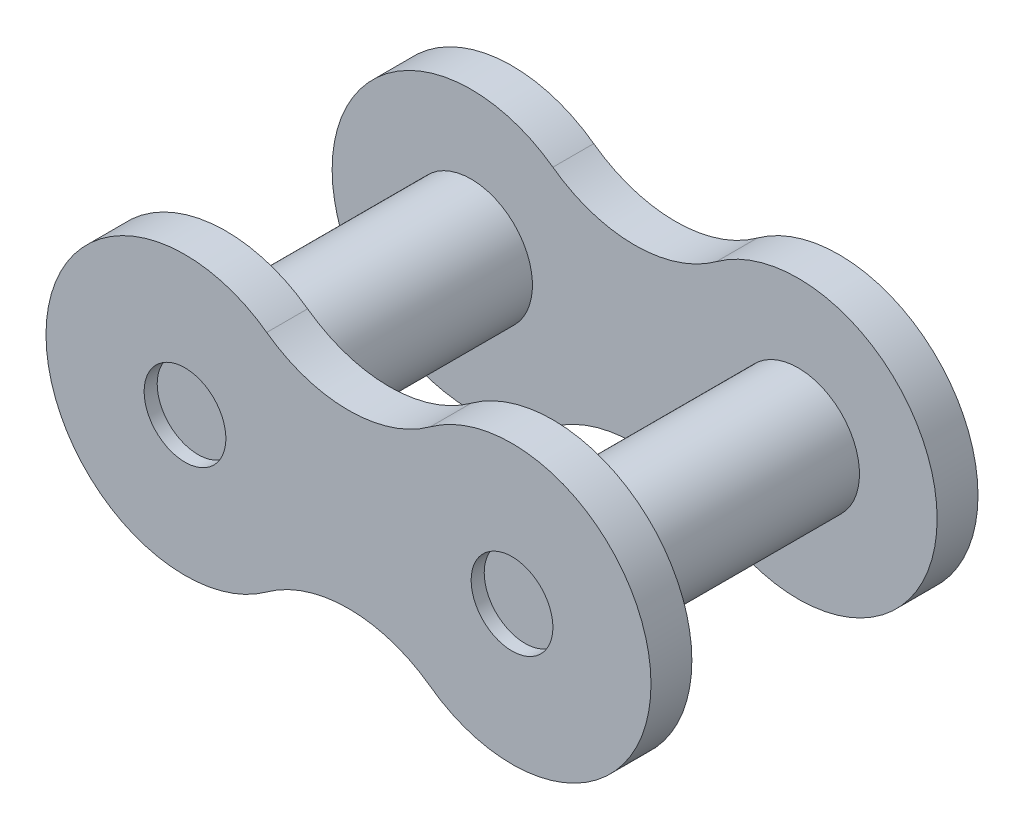
from build123d import *

# Parameters (mm, degrees)
SKETCH2_R           = 2.38125
SKETCH2_R_2         = 1.190625
BOSS_EXTRUDE1_DEPTH = 0.79375
SKETCH3_R           = 2.69875
SKETCH3_R_2         = 1.190625
BOSS_EXTRUDE2_DEPTH = 0.79375
BOSS_EXTRUDE3_START = 0.79375
SKETCH3_4_R         = 1.190625
BOSS_EXTRUDE3_DEPTH = 3.175
SKETCH4_R           = 0.79375
CUT_EXTRUDE1_DEPTH  = 0.254


with BuildPart() as part:
    # Sketch2 → Boss-Extrude1 (new body)
    # profile 1 of 3: a face of its own
    with BuildSketch(Plane.XY):
        Circle(SKETCH2_R)
        Circle(SKETCH2_R_2, mode=Mode.SUBTRACT)
    # profile 2 of 3: a face of its own
    with BuildSketch(Plane.XY):
        with BuildLine():
            ThreePointArc((1.5875, 1.774878957), (2.1737739, 0.972141242), (2.38125, 0))
            ThreePointArc((2.38125, 0), (2.1737739, -0.972141242), (1.5875, -1.774878957))
            ThreePointArc((1.5875, -1.774878957), (3.175, -1.168507914), (4.7625, -1.774878957))
            ThreePointArc((4.7625, -1.774878957), (3.96875, 0), (4.7625, 1.774878957))
            ThreePointArc((4.7625, 1.774878957), (3.175, 1.168507914), (1.5875, 1.774878957))
        make_face()
    # profile 3 of 3: a face of its own
    with BuildSketch(Plane.XY):
        with Locations((6.35, 0)):
            Circle(SKETCH2_R)
        with Locations((6.35, 0)):
            Circle(SKETCH2_R_2, mode=Mode.SUBTRACT)
    extrude(amount=BOSS_EXTRUDE1_DEPTH)


with BuildPart() as body_2:
    # Sketch3 → Boss-Extrude2 (new body)
    # profile 1 of 4: a face of its own
    with BuildSketch(Plane(origin=(0, 0, 0), x_dir=(-1, 0, 0), z_dir=(0, 0, -1))):
        with Locations((-12.7, 0)):
            Circle(SKETCH3_R)
        with Locations((-12.7, 0)):
            Circle(SKETCH3_R_2, mode=Mode.SUBTRACT)
    # profile 2 of 4: a face of its own
    with BuildSketch(Plane(origin=(0, 0, 0), x_dir=(-1, 0, 0), z_dir=(0, 0, -1))):
        with BuildLine():
            ThreePointArc((-3.65125, 0), (-3.737895814, 0.678353361), (-3.99226957, 1.313148424))
            ThreePointArc((-3.99226957, 1.313148424), (-4.399347966, 1.507376065), (-4.7625, 1.774878957))
            ThreePointArc((-4.7625, 1.774878957), (-8.73125, 0), (-4.7625, -1.774878957))
            ThreePointArc((-4.7625, -1.774878957), (-4.399347966, -1.507376065), (-3.99226957, -1.313148424))
            ThreePointArc((-3.99226957, -1.313148424), (-3.737895814, -0.678353361), (-3.65125, 0))
        make_face()
        with Locations(Location((-6.35, 0, 0), (0, 0, 180))):
            Circle(SKETCH3_R_2, mode=Mode.SUBTRACT)
    # profile 3 of 4: a face of its own
    with BuildSketch(Plane(origin=(0, 0, 0), x_dir=(-1, 0, 0), z_dir=(0, 0, -1))):
        with BuildLine():
            ThreePointArc((-3.99226957, 1.313148424), (-5.769279961, 2.63552951), (-7.9375, 2.182451675))
            ThreePointArc((-7.9375, 2.182451675), (-9.04875, 0), (-7.9375, -2.182451675))
            ThreePointArc((-7.9375, -2.182451675), (-5.769279961, -2.63552951), (-3.99226957, -1.313148424))
            ThreePointArc((-3.99226957, -1.313148424), (-4.399347966, -1.507376065), (-4.7625, -1.774878957))
            ThreePointArc((-4.7625, -1.774878957), (-8.73125, 0), (-4.7625, 1.774878957))
            ThreePointArc((-4.7625, 1.774878957), (-4.399347966, 1.507376065), (-3.99226957, 1.313148424))
        make_face()
    # profile 4 of 4: a face of its own
    with BuildSketch(Plane(origin=(0, 0, 0), x_dir=(-1, 0, 0), z_dir=(0, 0, -1))):
        with BuildLine():
            ThreePointArc((-7.9375, -2.182451675), (-9.04875, 0), (-7.9375, 2.182451675))
            ThreePointArc((-7.9375, 2.182451675), (-9.525, 1.666153349), (-11.1125, 2.182451675))
            ThreePointArc((-11.1125, 2.182451675), (-10.295055387, 1.224537859), (-10.00125, 0))
            ThreePointArc((-10.00125, 0), (-10.295055387, -1.224537859), (-11.1125, -2.182451675))
            ThreePointArc((-11.1125, -2.182451675), (-9.525, -1.666153349), (-7.9375, -2.182451675))
        make_face()
    extrude(amount=BOSS_EXTRUDE2_DEPTH)

    # Sketch3<4> → Boss-Extrude3 (add)
    with BuildSketch(Plane(origin=(0, 0, 0), x_dir=(-1, 0, 0), z_dir=(0, 0, -1)).offset(BOSS_EXTRUDE3_START)):
        with Locations(Location((-6.35, 0, 0), (0, 0, 180))):
            Circle(SKETCH3_4_R)
        with Locations((-12.7, 0)):
            Circle(SKETCH3_4_R)
    extrude(amount=-BOSS_EXTRUDE3_DEPTH)


with BuildPart() as body_3:
    # Mirror1: mirrored copy
    add(body_2.part.mirror(Plane(origin=(6.35, 0, 2.38125), x_dir=(1, 0, 0), z_dir=(0, 0, -1))))


with BuildPart() as body_4:
    # Mirror1 2: mirrored copy
    add(part.part.mirror(Plane(origin=(6.35, 0, 2.38125), x_dir=(1, 0, 0), z_dir=(0, 0, -1))))


with BuildPart() as body_2_1:
    add(body_2.part)

    # Combine1: union body 3
    add(body_3.part)

    # Sketch4 → Cut-Extrude1 (cut)
    with BuildSketch(Plane(origin=(0, 0, -0.79375), x_dir=(-1, 0, 0), z_dir=(0, 0, -1))):
        with Locations((-6.35, 0)):
            Circle(SKETCH4_R)
        with Locations((-12.7, 0)):
            Circle(SKETCH4_R)
    cut_extrude1 = extrude(amount=-CUT_EXTRUDE1_DEPTH, mode=Mode.SUBTRACT)

    # Mirror2: Cut-Extrude1 across plane
    add(cut_extrude1.mirror(Plane.XY.offset(2.38125)), mode=Mode.SUBTRACT)


solid = body_2_1.part
